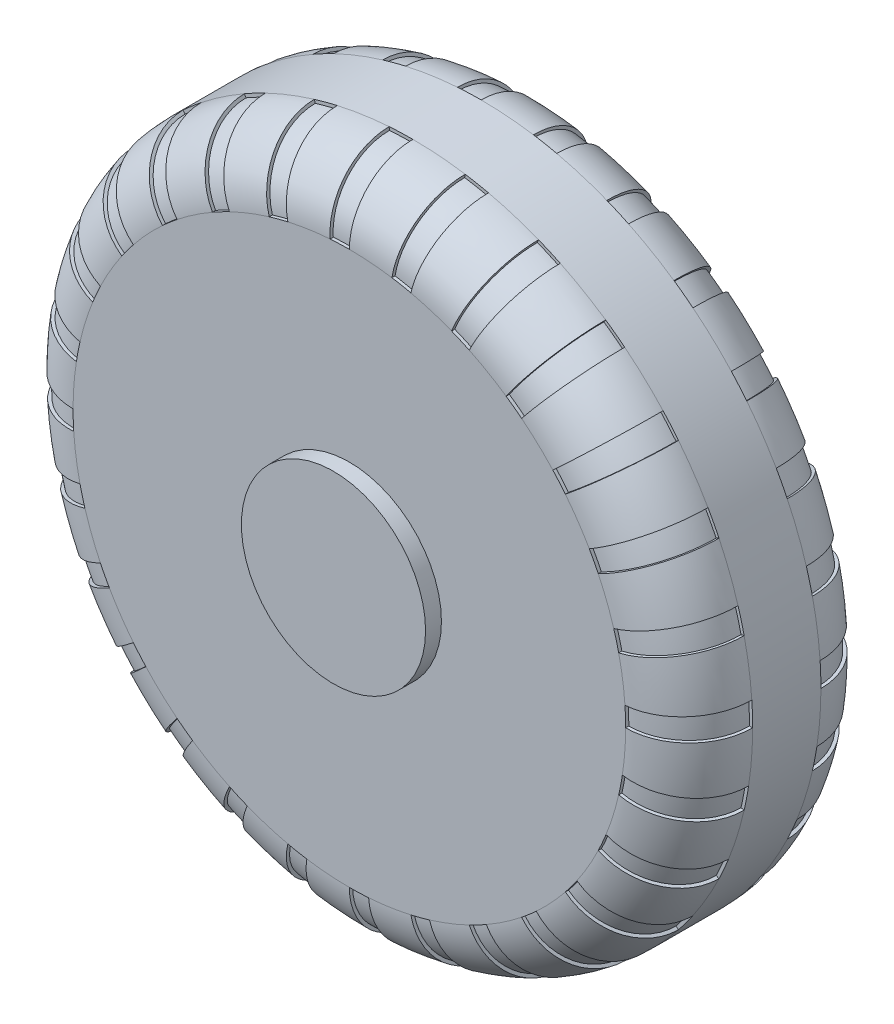
from build123d import *

# Parameters (mm, degrees)
EXTRUDE_1_DEPTH          = 30.75
EXTRUDE_1_DEPTH_BACK     = 30.75
SKETCH_1_R               = 107
FILLET_1_R               = 20
CUT_REVOLVE_1_ANGLE      = 4
PATTERN_CIRCULAR_1_COUNT = 28
MIRROR_2_COPY_1_ANGLE    = 4
MIRROR_2_COPY_2_ANGLE    = 4
MIRROR_2_COPY_3_ANGLE    = 4
MIRROR_2_COPY_4_ANGLE    = 4
MIRROR_2_COPY_5_ANGLE    = 4
MIRROR_2_COPY_6_ANGLE    = 4
MIRROR_2_COPY_7_ANGLE    = 4
MIRROR_2_COPY_8_ANGLE    = 4
MIRROR_2_COPY_9_ANGLE    = 4
MIRROR_2_COPY_10_ANGLE   = 4
MIRROR_2_COPY_11_ANGLE   = 4
MIRROR_2_COPY_12_ANGLE   = 4
MIRROR_2_COPY_13_ANGLE   = 4
MIRROR_2_COPY_14_ANGLE   = 4
MIRROR_2_COPY_15_ANGLE   = 4
MIRROR_2_COPY_16_ANGLE   = 4
MIRROR_2_COPY_17_ANGLE   = 4
MIRROR_2_COPY_18_ANGLE   = 4
MIRROR_2_COPY_19_ANGLE   = 4
MIRROR_2_COPY_20_ANGLE   = 4
MIRROR_2_COPY_21_ANGLE   = 4
MIRROR_2_COPY_22_ANGLE   = 4
MIRROR_2_COPY_23_ANGLE   = 4
MIRROR_2_COPY_24_ANGLE   = 4
MIRROR_2_COPY_25_ANGLE   = 4
MIRROR_2_COPY_26_ANGLE   = 4
MIRROR_2_COPY_27_ANGLE   = 4
MIRROR_2_COPY_28_ANGLE   = 4
SKETCH_3_R               = 29
EXTRUDE_2_DEPTH          = 23.5
EXTRUDE_START            = 5
SKETCH_4_R               = 29
EXTRUDE_3_DEPTH          = 5


with BuildPart() as part:
    # 스케치1 → 보스-돌출1 (new, two sides: drawn at the far end of the back side and taken through both)
    with BuildSketch(Plane.XY.offset(-EXTRUDE_1_DEPTH_BACK)):
        Circle(SKETCH_1_R)
    extrude(amount=EXTRUDE_1_DEPTH + EXTRUDE_1_DEPTH_BACK)

    # 필렛1
    fillet_1_edges = [part.edges().sort_by_distance(p)[0] for p in [
        (-107, 0, -30.75),
        (-107, 0, 30.75),
    ]]
    fillet(fillet_1_edges, radius=FILLET_1_R)

    # 스케치2 → 컷-회전1 (revolve, cut)
    with BuildSketch(Plane(origin=(0, 0, 0), x_dir=(0, 0, -1), z_dir=(1, 0, 0))):
        with BuildLine():
            Line((29.75, 87), (30.75, 87))
            ThreePointArc((30.75, 87), (24.892135624, 101.142135624), (10.75, 107))
            Line((10.75, 107), (10.75, 106))
            ThreePointArc((10.75, 106), (24.185028843, 100.435028843), (29.75, 87))
        make_face()
    cut_revolve_1 = revolve(axis=Axis((0, 0, -49.545758719), (0, 0, 1)), revolution_arc=CUT_REVOLVE_1_ANGLE, mode=Mode.SUBTRACT)

    # 원형 패턴1: 컷-회전1 ×28 about axis
    pattern_circular_1_axis = Axis((0, 0, -30.75), (0, 0, -1))
    for i in range(1, PATTERN_CIRCULAR_1_COUNT):
        add(cut_revolve_1.rotate(pattern_circular_1_axis, i * 360 / PATTERN_CIRCULAR_1_COUNT), mode=Mode.SUBTRACT)

    # 대칭 복사2 copy 1 sketch → 대칭 복사2 copy 1 (revolve, cut)
    with BuildSketch(Plane(origin=(0, 0, 0), x_dir=(0, 0, 1), z_dir=(0.9749279121818236, -0.2225209339563144, 0))):
        with BuildLine():
            Line((29.75, -87), (30.75, -87))
            ThreePointArc((30.75, -87), (24.892135624, -101.142135624), (10.75, -107))
            Line((10.75, -107), (10.75, -106))
            ThreePointArc((10.75, -106), (24.185028843, -100.435028843), (29.75, -87))
        make_face()
    revolve(axis=Axis((0, 0, 49.545758719), (0, 0, 1)), revolution_arc=MIRROR_2_COPY_1_ANGLE, mode=Mode.SUBTRACT)

    # 대칭 복사2 copy 2 sketch → 대칭 복사2 copy 2 (revolve, cut)
    with BuildSketch(Plane(origin=(0, 0, 0), x_dir=(0, 0, 1), z_dir=(0.9009688679024191, -0.4338837391175581, 0))):
        with BuildLine():
            Line((29.75, -87), (30.75, -87))
            ThreePointArc((30.75, -87), (24.892135624, -101.142135624), (10.75, -107))
            Line((10.75, -107), (10.75, -106))
            ThreePointArc((10.75, -106), (24.185028843, -100.435028843), (29.75, -87))
        make_face()
    revolve(axis=Axis((0, 0, 49.545758719), (0, 0, 1)), revolution_arc=MIRROR_2_COPY_2_ANGLE, mode=Mode.SUBTRACT)

    # 대칭 복사2 copy 3 sketch → 대칭 복사2 copy 3 (revolve, cut)
    with BuildSketch(Plane(origin=(0, 0, 0), x_dir=(0, 0, 1), z_dir=(0.7818314824680298, -0.6234898018587335, 0))):
        with BuildLine():
            Line((29.75, -87), (30.75, -87))
            ThreePointArc((30.75, -87), (24.892135624, -101.142135624), (10.75, -107))
            Line((10.75, -107), (10.75, -106))
            ThreePointArc((10.75, -106), (24.185028843, -100.435028843), (29.75, -87))
        make_face()
    revolve(axis=Axis((0, 0, 49.545758719), (0, 0, 1)), revolution_arc=MIRROR_2_COPY_3_ANGLE, mode=Mode.SUBTRACT)

    # 대칭 복사2 copy 4 sketch → 대칭 복사2 copy 4 (revolve, cut)
    with BuildSketch(Plane(origin=(0, 0, 0), x_dir=(0, 0, 1), z_dir=(0.6234898018587336, -0.7818314824680298, 0))):
        with BuildLine():
            Line((29.75, -87), (30.75, -87))
            ThreePointArc((30.75, -87), (24.892135624, -101.142135624), (10.75, -107))
            Line((10.75, -107), (10.75, -106))
            ThreePointArc((10.75, -106), (24.185028843, -100.435028843), (29.75, -87))
        make_face()
    revolve(axis=Axis((0, 0, 49.545758719), (0, 0, 1)), revolution_arc=MIRROR_2_COPY_4_ANGLE, mode=Mode.SUBTRACT)

    # 대칭 복사2 copy 5 sketch → 대칭 복사2 copy 5 (revolve, cut)
    with BuildSketch(Plane(origin=(0, 0, 0), x_dir=(0, 0, 1), z_dir=(0.43388373911755795, -0.9009688679024193, 0))):
        with BuildLine():
            Line((29.75, -87), (30.75, -87))
            ThreePointArc((30.75, -87), (24.892135624, -101.142135624), (10.75, -107))
            Line((10.75, -107), (10.75, -106))
            ThreePointArc((10.75, -106), (24.185028843, -100.435028843), (29.75, -87))
        make_face()
    revolve(axis=Axis((0, 0, 49.545758719), (0, 0, 1)), revolution_arc=MIRROR_2_COPY_5_ANGLE, mode=Mode.SUBTRACT)

    # 대칭 복사2 copy 6 sketch → 대칭 복사2 copy 6 (revolve, cut)
    with BuildSketch(Plane(origin=(0, 0, 0), x_dir=(0, 0, 1), z_dir=(0.22252093395631445, -0.9749279121818236, 0))):
        with BuildLine():
            Line((29.75, -87), (30.75, -87))
            ThreePointArc((30.75, -87), (24.892135624, -101.142135624), (10.75, -107))
            Line((10.75, -107), (10.75, -106))
            ThreePointArc((10.75, -106), (24.185028843, -100.435028843), (29.75, -87))
        make_face()
    revolve(axis=Axis((0, 0, 49.545758719), (0, 0, 1)), revolution_arc=MIRROR_2_COPY_6_ANGLE, mode=Mode.SUBTRACT)

    # 대칭 복사2 copy 7 sketch → 대칭 복사2 copy 7 (revolve, cut)
    with BuildSketch(Plane(origin=(0, 0, 0), x_dir=(0, 0, 1), z_dir=(0, -1, 0))):
        with BuildLine():
            Line((29.75, -87), (30.75, -87))
            ThreePointArc((30.75, -87), (24.892135624, -101.142135624), (10.75, -107))
            Line((10.75, -107), (10.75, -106))
            ThreePointArc((10.75, -106), (24.185028843, -100.435028843), (29.75, -87))
        make_face()
    revolve(axis=Axis((0, 0, 49.545758719), (0, 0, 1)), revolution_arc=MIRROR_2_COPY_7_ANGLE, mode=Mode.SUBTRACT)

    # 대칭 복사2 copy 8 sketch → 대칭 복사2 copy 8 (revolve, cut)
    with BuildSketch(Plane(origin=(0, 0, 0), x_dir=(0, 0, 1), z_dir=(-0.22252093395631434, -0.9749279121818236, 0))):
        with BuildLine():
            Line((29.75, -87), (30.75, -87))
            ThreePointArc((30.75, -87), (24.892135624, -101.142135624), (10.75, -107))
            Line((10.75, -107), (10.75, -106))
            ThreePointArc((10.75, -106), (24.185028843, -100.435028843), (29.75, -87))
        make_face()
    revolve(axis=Axis((0, 0, 49.545758719), (0, 0, 1)), revolution_arc=MIRROR_2_COPY_8_ANGLE, mode=Mode.SUBTRACT)

    # 대칭 복사2 copy 9 sketch → 대칭 복사2 copy 9 (revolve, cut)
    with BuildSketch(Plane(origin=(0, 0, 0), x_dir=(0, 0, 1), z_dir=(-0.43388373911755806, -0.9009688679024191, 0))):
        with BuildLine():
            Line((29.75, -87), (30.75, -87))
            ThreePointArc((30.75, -87), (24.892135624, -101.142135624), (10.75, -107))
            Line((10.75, -107), (10.75, -106))
            ThreePointArc((10.75, -106), (24.185028843, -100.435028843), (29.75, -87))
        make_face()
    revolve(axis=Axis((0, 0, 49.545758719), (0, 0, 1)), revolution_arc=MIRROR_2_COPY_9_ANGLE, mode=Mode.SUBTRACT)

    # 대칭 복사2 copy 10 sketch → 대칭 복사2 copy 10 (revolve, cut)
    with BuildSketch(Plane(origin=(0, 0, 0), x_dir=(0, 0, 1), z_dir=(-0.6234898018587338, -0.7818314824680296, 0))):
        with BuildLine():
            Line((29.75, -87), (30.75, -87))
            ThreePointArc((30.75, -87), (24.892135624, -101.142135624), (10.75, -107))
            Line((10.75, -107), (10.75, -106))
            ThreePointArc((10.75, -106), (24.185028843, -100.435028843), (29.75, -87))
        make_face()
    revolve(axis=Axis((0, 0, 49.545758719), (0, 0, 1)), revolution_arc=MIRROR_2_COPY_10_ANGLE, mode=Mode.SUBTRACT)

    # 대칭 복사2 copy 11 sketch → 대칭 복사2 copy 11 (revolve, cut)
    with BuildSketch(Plane(origin=(0, 0, 0), x_dir=(0, 0, 1), z_dir=(-0.78183148246803, -0.6234898018587333, 0))):
        with BuildLine():
            Line((29.75, -87), (30.75, -87))
            ThreePointArc((30.75, -87), (24.892135624, -101.142135624), (10.75, -107))
            Line((10.75, -107), (10.75, -106))
            ThreePointArc((10.75, -106), (24.185028843, -100.435028843), (29.75, -87))
        make_face()
    revolve(axis=Axis((0, 0, 49.545758719), (0, 0, 1)), revolution_arc=MIRROR_2_COPY_11_ANGLE, mode=Mode.SUBTRACT)

    # 대칭 복사2 copy 12 sketch → 대칭 복사2 copy 12 (revolve, cut)
    with BuildSketch(Plane(origin=(0, 0, 0), x_dir=(0, 0, 1), z_dir=(-0.900968867902419, -0.43388373911755823, 0))):
        with BuildLine():
            Line((29.75, -87), (30.75, -87))
            ThreePointArc((30.75, -87), (24.892135624, -101.142135624), (10.75, -107))
            Line((10.75, -107), (10.75, -106))
            ThreePointArc((10.75, -106), (24.185028843, -100.435028843), (29.75, -87))
        make_face()
    revolve(axis=Axis((0, 0, 49.545758719), (0, 0, 1)), revolution_arc=MIRROR_2_COPY_12_ANGLE, mode=Mode.SUBTRACT)

    # 대칭 복사2 copy 13 sketch → 대칭 복사2 copy 13 (revolve, cut)
    with BuildSketch(Plane(origin=(0, 0, 0), x_dir=(0, 0, 1), z_dir=(-0.9749279121818236, -0.2225209339563145, 0))):
        with BuildLine():
            Line((29.75, -87), (30.75, -87))
            ThreePointArc((30.75, -87), (24.892135624, -101.142135624), (10.75, -107))
            Line((10.75, -107), (10.75, -106))
            ThreePointArc((10.75, -106), (24.185028843, -100.435028843), (29.75, -87))
        make_face()
    revolve(axis=Axis((0, 0, 49.545758719), (0, 0, 1)), revolution_arc=MIRROR_2_COPY_13_ANGLE, mode=Mode.SUBTRACT)

    # 대칭 복사2 copy 14 sketch → 대칭 복사2 copy 14 (revolve, cut)
    with BuildSketch(Plane.ZY):
        with BuildLine():
            Line((29.75, -87), (30.75, -87))
            ThreePointArc((30.75, -87), (24.892135624, -101.142135624), (10.75, -107))
            Line((10.75, -107), (10.75, -106))
            ThreePointArc((10.75, -106), (24.185028843, -100.435028843), (29.75, -87))
        make_face()
    revolve(axis=Axis((0, 0, 49.545758719), (0, 0, 1)), revolution_arc=MIRROR_2_COPY_14_ANGLE, mode=Mode.SUBTRACT)

    # 대칭 복사2 copy 15 sketch → 대칭 복사2 copy 15 (revolve, cut)
    with BuildSketch(Plane(origin=(0, 0, 0), x_dir=(0, 0, 1), z_dir=(-0.9749279121818236, 0.22252093395631428, 0))):
        with BuildLine():
            Line((29.75, -87), (30.75, -87))
            ThreePointArc((30.75, -87), (24.892135624, -101.142135624), (10.75, -107))
            Line((10.75, -107), (10.75, -106))
            ThreePointArc((10.75, -106), (24.185028843, -100.435028843), (29.75, -87))
        make_face()
    revolve(axis=Axis((0, 0, 49.545758719), (0, 0, 1)), revolution_arc=MIRROR_2_COPY_15_ANGLE, mode=Mode.SUBTRACT)

    # 대칭 복사2 copy 16 sketch → 대칭 복사2 copy 16 (revolve, cut)
    with BuildSketch(Plane(origin=(0, 0, 0), x_dir=(0, 0, 1), z_dir=(-0.9009688679024191, 0.433883739117558, 0))):
        with BuildLine():
            Line((29.75, -87), (30.75, -87))
            ThreePointArc((30.75, -87), (24.892135624, -101.142135624), (10.75, -107))
            Line((10.75, -107), (10.75, -106))
            ThreePointArc((10.75, -106), (24.185028843, -100.435028843), (29.75, -87))
        make_face()
    revolve(axis=Axis((0, 0, 49.545758719), (0, 0, 1)), revolution_arc=MIRROR_2_COPY_16_ANGLE, mode=Mode.SUBTRACT)

    # 대칭 복사2 copy 17 sketch → 대칭 복사2 copy 17 (revolve, cut)
    with BuildSketch(Plane(origin=(0, 0, 0), x_dir=(0, 0, 1), z_dir=(-0.7818314824680296, 0.6234898018587338, 0))):
        with BuildLine():
            Line((29.75, -87), (30.75, -87))
            ThreePointArc((30.75, -87), (24.892135624, -101.142135624), (10.75, -107))
            Line((10.75, -107), (10.75, -106))
            ThreePointArc((10.75, -106), (24.185028843, -100.435028843), (29.75, -87))
        make_face()
    revolve(axis=Axis((0, 0, 49.545758719), (0, 0, 1)), revolution_arc=MIRROR_2_COPY_17_ANGLE, mode=Mode.SUBTRACT)

    # 대칭 복사2 copy 18 sketch → 대칭 복사2 copy 18 (revolve, cut)
    with BuildSketch(Plane(origin=(0, 0, 0), x_dir=(0, 0, 1), z_dir=(-0.6234898018587337, 0.7818314824680297, 0))):
        with BuildLine():
            Line((29.75, -87), (30.75, -87))
            ThreePointArc((30.75, -87), (24.892135624, -101.142135624), (10.75, -107))
            Line((10.75, -107), (10.75, -106))
            ThreePointArc((10.75, -106), (24.185028843, -100.435028843), (29.75, -87))
        make_face()
    revolve(axis=Axis((0, 0, 49.545758719), (0, 0, 1)), revolution_arc=MIRROR_2_COPY_18_ANGLE, mode=Mode.SUBTRACT)

    # 대칭 복사2 copy 19 sketch → 대칭 복사2 copy 19 (revolve, cut)
    with BuildSketch(Plane(origin=(0, 0, 0), x_dir=(0, 0, 1), z_dir=(-0.43388373911755745, 0.9009688679024195, 0))):
        with BuildLine():
            Line((29.75, -87), (30.75, -87))
            ThreePointArc((30.75, -87), (24.892135624, -101.142135624), (10.75, -107))
            Line((10.75, -107), (10.75, -106))
            ThreePointArc((10.75, -106), (24.185028843, -100.435028843), (29.75, -87))
        make_face()
    revolve(axis=Axis((0, 0, 49.545758719), (0, 0, 1)), revolution_arc=MIRROR_2_COPY_19_ANGLE, mode=Mode.SUBTRACT)

    # 대칭 복사2 copy 20 sketch → 대칭 복사2 copy 20 (revolve, cut)
    with BuildSketch(Plane(origin=(0, 0, 0), x_dir=(0, 0, 1), z_dir=(-0.2225209339563137, 0.9749279121818237, 0))):
        with BuildLine():
            Line((29.75, -87), (30.75, -87))
            ThreePointArc((30.75, -87), (24.892135624, -101.142135624), (10.75, -107))
            Line((10.75, -107), (10.75, -106))
            ThreePointArc((10.75, -106), (24.185028843, -100.435028843), (29.75, -87))
        make_face()
    revolve(axis=Axis((0, 0, 49.545758719), (0, 0, 1)), revolution_arc=MIRROR_2_COPY_20_ANGLE, mode=Mode.SUBTRACT)

    # 대칭 복사2 copy 21 sketch → 대칭 복사2 copy 21 (revolve, cut)
    with BuildSketch(Plane.ZX):
        with BuildLine():
            Line((29.75, -87), (30.75, -87))
            ThreePointArc((30.75, -87), (24.892135624, -101.142135624), (10.75, -107))
            Line((10.75, -107), (10.75, -106))
            ThreePointArc((10.75, -106), (24.185028843, -100.435028843), (29.75, -87))
        make_face()
    revolve(axis=Axis((0, 0, 49.545758719), (0, 0, 1)), revolution_arc=MIRROR_2_COPY_21_ANGLE, mode=Mode.SUBTRACT)

    # 대칭 복사2 copy 22 sketch → 대칭 복사2 copy 22 (revolve, cut)
    with BuildSketch(Plane(origin=(0, 0, 0), x_dir=(0, 0, 1), z_dir=(0.2225209339563151, 0.9749279121818234, 0))):
        with BuildLine():
            Line((29.75, -87), (30.75, -87))
            ThreePointArc((30.75, -87), (24.892135624, -101.142135624), (10.75, -107))
            Line((10.75, -107), (10.75, -106))
            ThreePointArc((10.75, -106), (24.185028843, -100.435028843), (29.75, -87))
        make_face()
    revolve(axis=Axis((0, 0, 49.545758719), (0, 0, 1)), revolution_arc=MIRROR_2_COPY_22_ANGLE, mode=Mode.SUBTRACT)

    # 대칭 복사2 copy 23 sketch → 대칭 복사2 copy 23 (revolve, cut)
    with BuildSketch(Plane(origin=(0, 0, 0), x_dir=(0, 0, 1), z_dir=(0.43388373911755795, 0.9009688679024193, 0))):
        with BuildLine():
            Line((29.75, -87), (30.75, -87))
            ThreePointArc((30.75, -87), (24.892135624, -101.142135624), (10.75, -107))
            Line((10.75, -107), (10.75, -106))
            ThreePointArc((10.75, -106), (24.185028843, -100.435028843), (29.75, -87))
        make_face()
    revolve(axis=Axis((0, 0, 49.545758719), (0, 0, 1)), revolution_arc=MIRROR_2_COPY_23_ANGLE, mode=Mode.SUBTRACT)

    # 대칭 복사2 copy 24 sketch → 대칭 복사2 copy 24 (revolve, cut)
    with BuildSketch(Plane(origin=(0, 0, 0), x_dir=(0, 0, 1), z_dir=(0.6234898018587334, 0.7818314824680299, 0))):
        with BuildLine():
            Line((29.75, -87), (30.75, -87))
            ThreePointArc((30.75, -87), (24.892135624, -101.142135624), (10.75, -107))
            Line((10.75, -107), (10.75, -106))
            ThreePointArc((10.75, -106), (24.185028843, -100.435028843), (29.75, -87))
        make_face()
    revolve(axis=Axis((0, 0, 49.545758719), (0, 0, 1)), revolution_arc=MIRROR_2_COPY_24_ANGLE, mode=Mode.SUBTRACT)

    # 대칭 복사2 copy 25 sketch → 대칭 복사2 copy 25 (revolve, cut)
    with BuildSketch(Plane(origin=(0, 0, 0), x_dir=(0, 0, 1), z_dir=(0.7818314824680297, 0.6234898018587337, 0))):
        with BuildLine():
            Line((29.75, -87), (30.75, -87))
            ThreePointArc((30.75, -87), (24.892135624, -101.142135624), (10.75, -107))
            Line((10.75, -107), (10.75, -106))
            ThreePointArc((10.75, -106), (24.185028843, -100.435028843), (29.75, -87))
        make_face()
    revolve(axis=Axis((0, 0, 49.545758719), (0, 0, 1)), revolution_arc=MIRROR_2_COPY_25_ANGLE, mode=Mode.SUBTRACT)

    # 대칭 복사2 copy 26 sketch → 대칭 복사2 copy 26 (revolve, cut)
    with BuildSketch(Plane(origin=(0, 0, 0), x_dir=(0, 0, 1), z_dir=(0.900968867902419, 0.43388373911755834, 0))):
        with BuildLine():
            Line((29.75, -87), (30.75, -87))
            ThreePointArc((30.75, -87), (24.892135624, -101.142135624), (10.75, -107))
            Line((10.75, -107), (10.75, -106))
            ThreePointArc((10.75, -106), (24.185028843, -100.435028843), (29.75, -87))
        make_face()
    revolve(axis=Axis((0, 0, 49.545758719), (0, 0, 1)), revolution_arc=MIRROR_2_COPY_26_ANGLE, mode=Mode.SUBTRACT)

    # 대칭 복사2 copy 27 sketch → 대칭 복사2 copy 27 (revolve, cut)
    with BuildSketch(Plane(origin=(0, 0, 0), x_dir=(0, 0, 1), z_dir=(0.9749279121818237, 0.22252093395631378, 0))):
        with BuildLine():
            Line((29.75, -87), (30.75, -87))
            ThreePointArc((30.75, -87), (24.892135624, -101.142135624), (10.75, -107))
            Line((10.75, -107), (10.75, -106))
            ThreePointArc((10.75, -106), (24.185028843, -100.435028843), (29.75, -87))
        make_face()
    revolve(axis=Axis((0, 0, 49.545758719), (0, 0, 1)), revolution_arc=MIRROR_2_COPY_27_ANGLE, mode=Mode.SUBTRACT)

    # 대칭 복사2 copy 28 sketch → 대칭 복사2 copy 28 (revolve, cut)
    with BuildSketch(Plane(origin=(0, 0, 0), x_dir=(0, 0, 1), z_dir=(1, 0, 0))):
        with BuildLine():
            Line((29.75, -87), (30.75, -87))
            ThreePointArc((30.75, -87), (24.892135624, -101.142135624), (10.75, -107))
            Line((10.75, -107), (10.75, -106))
            ThreePointArc((10.75, -106), (24.185028843, -100.435028843), (29.75, -87))
        make_face()
    revolve(axis=Axis((0, 0, 49.545758719), (0, 0, 1)), revolution_arc=MIRROR_2_COPY_28_ANGLE, mode=Mode.SUBTRACT)

    # 스케치3 → 보스-돌출2 (add)
    with BuildSketch(Plane(origin=(0, 0, -30.75), x_dir=(-1, 0, 0), z_dir=(0, 0, -1))):
        Circle(SKETCH_3_R)
    extrude(amount=EXTRUDE_2_DEPTH)

    # 스케치4 → 보스-돌출3 (add)
    with BuildSketch(Plane.XY.offset(30.75).offset(EXTRUDE_START)):
        Circle(SKETCH_4_R)
    extrude(amount=-EXTRUDE_3_DEPTH)


solid = part.part
